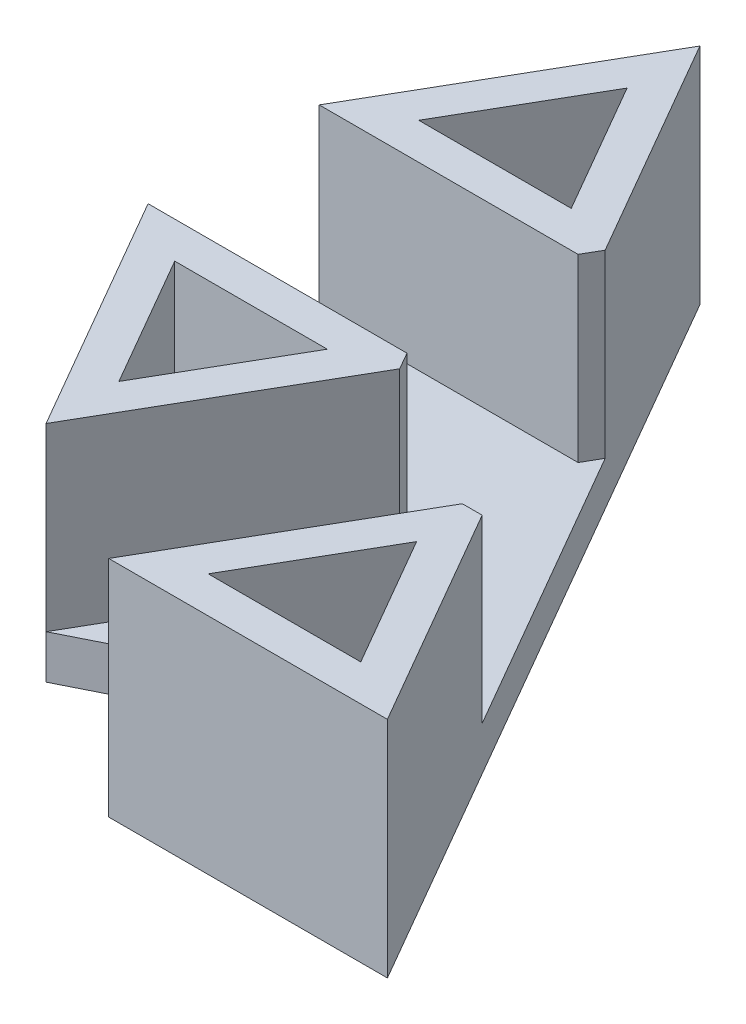
from build123d import *

# Parameters (mm, degrees)
BOSS_EXTRUDE3_DEPTH   = 15.38
BOSS_EXTRUDE3_2_DEPTH = 15.38
BOSS_EXTRUDE3_3_DEPTH = 15.38
BOSS_EXTRUDE5_DEPTH   = 3


with BuildPart() as part:
    # Sketch1 → Boss-Extrude3 (new body)
    with BuildSketch(Plane(origin=(0, 0, 0), x_dir=(1, 0, 0), z_dir=(0, 1, 0))):
        Polygon((-138.959292143, 15.392304845), (-130.072540797, 0), (-130.752776749, -1.17820323), (-148.526279441, -1.17820323), align=None)
        Polygon((-144.196152422, 1.32179677), (-133.722431864, 1.32179677), (-138.959292143, 10.392304845), align=None, mode=Mode.SUBTRACT)
    extrude(amount=BOSS_EXTRUDE3_DEPTH)



with BuildPart() as body_2:
    # Sketch1 → Boss-Extrude3 2 (new body)
    with BuildSketch(Plane(origin=(0, 0, 0), x_dir=(1, 0, 0), z_dir=(0, 1, 0))):
        Polygon((-130.752776749, -12.92820323), (-130.072540797, -14.106406459), (-138.959292143, -29.498711305), (-148.526279441, -12.92820323), align=None)
        Polygon((-144.196152422, -15.42820323), (-138.959292143, -24.498711305), (-133.722431864, -15.42820323), align=None, mode=Mode.SUBTRACT)
    extrude(amount=BOSS_EXTRUDE3_2_DEPTH)


with BuildPart() as body_3:
    # Sketch1 → Boss-Extrude3 3 (new body)
    with BuildSketch(Plane(origin=(0, 0, 0), x_dir=(1, 0, 0), z_dir=(0, 1, 0))):
        Polygon((-128.783493648, -35.373711305), (-119.896742302, -19.981406459), (-118.536270399, -19.981406459), (-109.649519053, -35.373711305), align=None)
        Polygon((-113.979646072, -32.873711305), (-119.216506351, -23.80320323), (-124.453366629, -32.873711305), align=None, mode=Mode.SUBTRACT)
    extrude(amount=BOSS_EXTRUDE3_3_DEPTH)


with BuildPart() as part_1:
    add(part.part)

    add(body_2.part)  # Boss-Extrude5 merges body 2

    add(body_3.part)  # Boss-Extrude5 merges body 3
    # Sketch1<7> → Boss-Extrude5 (add)
    with BuildSketch(Plane(origin=(0, 0, 0), x_dir=(1, 0, 0), z_dir=(0, 1, 0))):
        Polygon((-118.536270399, -19.981406459), (-130.072540797, 0), (-130.752776749, -1.17820323), (-148.526279441, -1.17820323), (-139.639528095, -7.05320323), (-148.526279441, -12.92820323), (-130.752776749, -12.92820323), (-130.072540797, -14.106406459), (-138.959292143, -29.498711305), (-129.428017223, -24.740058882), (-128.783493648, -35.373711305), (-119.896742302, -19.981406459), align=None)
    extrude(amount=BOSS_EXTRUDE5_DEPTH)


solid = part_1.part
